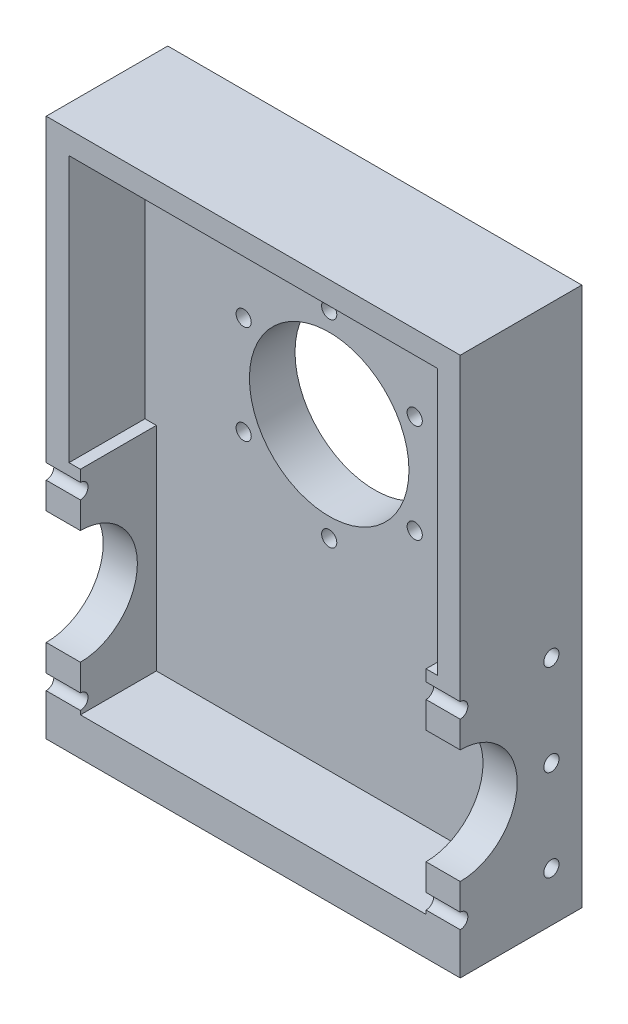
from build123d import *

# Parameters (mm, degrees)
SKETCH1_W           = 97
SKETCH1_H           = 130
BOSS_EXTRUDE1_DEPTH = 12
SKETCH9_R           = 21
SKETCH9_R_2         = 2
CUT_EXTRUDE2_DEPTH  = 12
SKETCH11_W          = 109
SKETCH11_H          = 142
SKETCH11_W_2        = 97
SKETCH11_H_2        = 130
BOSS_EXTRUDE4_DEPTH = 32
SKETCH18_W          = 20
SKETCH18_H          = 60
BOSS_EXTRUDE5_DEPTH = 3
SKETCH14_R          = 15
CUT_EXTRUDE5_DEPTH  = 134.962681371
SKETCH20_W          = 91
SKETCH20_H          = 20
BOSS_EXTRUDE6_DEPTH = 4
SKETCH21_R          = 2
CUT_EXTRUDE6_DEPTH  = 9


with BuildPart() as part:
    # Sketch1 → Boss-Extrude1 (new body)
    with BuildSketch(Plane.XY):
        Rectangle(SKETCH1_W, SKETCH1_H)
    extrude(amount=BOSS_EXTRUDE1_DEPTH)

    # Sketch9 → Cut-Extrude2 (cut)
    with BuildSketch(Plane.XY.offset(12)):
        with Locations((0, 18)):
            Circle(SKETCH9_R)
        with Locations((0, 44)):
            Circle(SKETCH9_R_2)
        with Locations((22.516660498, 31)):
            Circle(SKETCH9_R_2)
        with Locations((22.516660498, 5)):
            Circle(SKETCH9_R_2)
        with Locations((0, -8)):
            Circle(SKETCH9_R_2)
        with Locations((-22.516660498, 5)):
            Circle(SKETCH9_R_2)
        with Locations((-22.516660498, 31)):
            Circle(SKETCH9_R_2)
    extrude(amount=-CUT_EXTRUDE2_DEPTH, mode=Mode.SUBTRACT)

    # Sketch11 → Boss-Extrude4 (add)
    with BuildSketch(Plane.XY):
        Rectangle(SKETCH11_W, SKETCH11_H)
        Rectangle(SKETCH11_W_2, SKETCH11_H_2, mode=Mode.SUBTRACT)
    extrude(amount=BOSS_EXTRUDE4_DEPTH)

    # Sketch18 → Boss-Extrude5 (add)
    with BuildSketch(Plane(origin=(-48.5, 0, 0), x_dir=(0, 0, -1), z_dir=(1, 0, 0))):
        with Locations((-22, -35)):
            Rectangle(SKETCH18_W, SKETCH18_H)
    boss_extrude5 = extrude(amount=BOSS_EXTRUDE5_DEPTH)

    # Mirror1: Boss-Extrude5 across plane
    add(boss_extrude5.mirror(Plane(origin=(0, 0, 0), x_dir=(0, 0, 1), z_dir=(1, 0, 0))))

    # Sketch14 → Cut-Extrude5 (cut, through all)
    with BuildSketch(Plane.ZY.offset(54.5)):
        with Locations((32, -34)):
            Circle(SKETCH14_R)
    extrude(amount=-CUT_EXTRUDE5_DEPTH, mode=Mode.SUBTRACT)

    # Sketch20 → Boss-Extrude6 (add)
    with BuildSketch(Plane(origin=(0, -65, 0), x_dir=(1, 0, 0), z_dir=(0, 1, 0))):
        with Locations((0, -22)):
            Rectangle(SKETCH20_W, SKETCH20_H)
    extrude(amount=BOSS_EXTRUDE6_DEPTH)

    # Sketch21 → Cut-Extrude6 (cut)
    with BuildSketch(Plane.ZY.offset(54.5)):
        with Locations((32, -10)):
            Circle(SKETCH21_R)
        with Locations((8, -10)):
            Circle(SKETCH21_R)
        with Locations((56, -10)):
            Circle(SKETCH21_R)
        with Locations((56, -58)):
            Circle(SKETCH21_R)
        with Locations((32, -58)):
            Circle(SKETCH21_R)
        with Locations(Location((8, -58, 0), (0, 0, 180))):
            Circle(SKETCH21_R)
        with Locations((8, -34)):
            Circle(SKETCH21_R)
    cut_extrude6 = extrude(amount=-CUT_EXTRUDE6_DEPTH, mode=Mode.SUBTRACT)

    # Mirror2: Cut-Extrude6 across plane
    add(cut_extrude6.mirror(Plane(origin=(0, 0, 0), x_dir=(0, 0, 1), z_dir=(1, 0, 0))), mode=Mode.SUBTRACT)


solid = part.part
